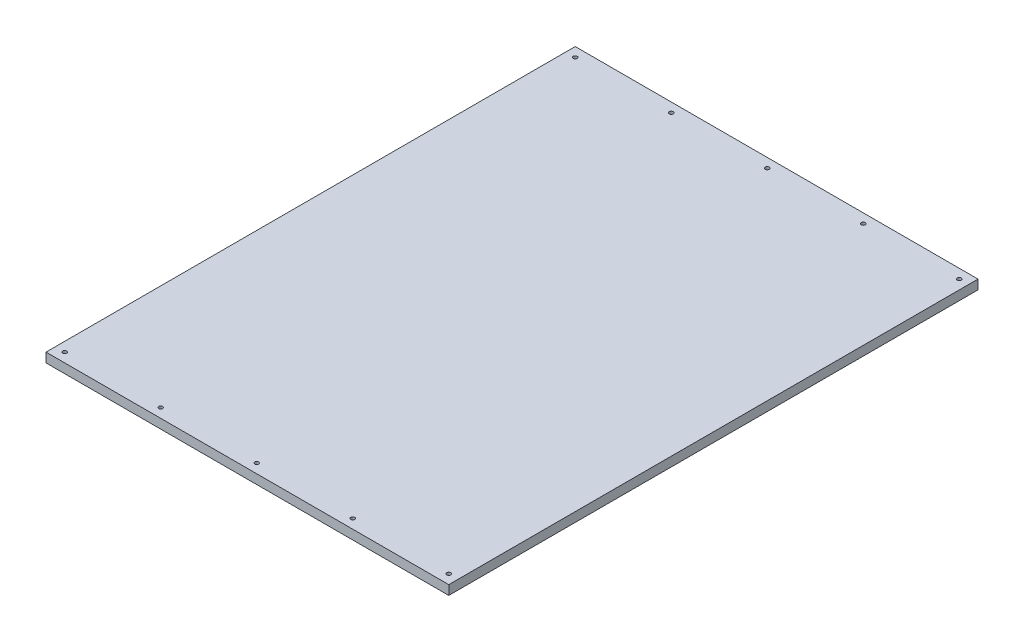
from build123d import *

# Parameters (mm, degrees)
SKETCH1_W           = 430
SKETCH1_H           = 565
BOSS_EXTRUDE1_DEPTH = 10
SKETCH2_R           = 2.1
CUT_EXTRUDE1_DEPTH  = 10


with BuildPart() as part:
    # Sketch1 → Boss-Extrude1 (new body)
    with BuildSketch(Plane(origin=(0, 0, 0), x_dir=(1, 0, 0), z_dir=(0, 1, 0))):
        Rectangle(SKETCH1_W, SKETCH1_H)
    extrude(amount=BOSS_EXTRUDE1_DEPTH)

    # Sketch2 → Cut-Extrude1 (cut)
    with BuildSketch(Plane(origin=(0, 10, 0), x_dir=(1, 0, 0), z_dir=(0, 1, 0))):
        with Locations(Location((0, 272.5, 0), (0, 0, 270))):
            Circle(SKETCH2_R)
        with Locations(Location((102.5, 272.5, 0), (0, 0, 270))):
            Circle(SKETCH2_R)
        with Locations(Location((205, 272.5, 0), (0, 0, 270))):
            Circle(SKETCH2_R)
        with Locations(Location((-102.5, 272.5, 0), (0, 0, 270))):
            Circle(SKETCH2_R)
        with Locations(Location((-205, 272.5, 0), (0, 0, 270))):
            Circle(SKETCH2_R)
        with Locations(Location((205, -272.5, 0), (0, 0, 90))):
            Circle(SKETCH2_R)
        with Locations(Location((102.5, -272.5, 0), (0, 0, 90))):
            Circle(SKETCH2_R)
        with Locations(Location((0, -272.5, 0), (0, 0, 90))):
            Circle(SKETCH2_R)
        with Locations(Location((-102.5, -272.5, 0), (0, 0, 90))):
            Circle(SKETCH2_R)
        with Locations(Location((-205, -272.5, 0), (0, 0, 90))):
            Circle(SKETCH2_R)
    extrude(amount=-CUT_EXTRUDE1_DEPTH, mode=Mode.SUBTRACT)


solid = part.part
